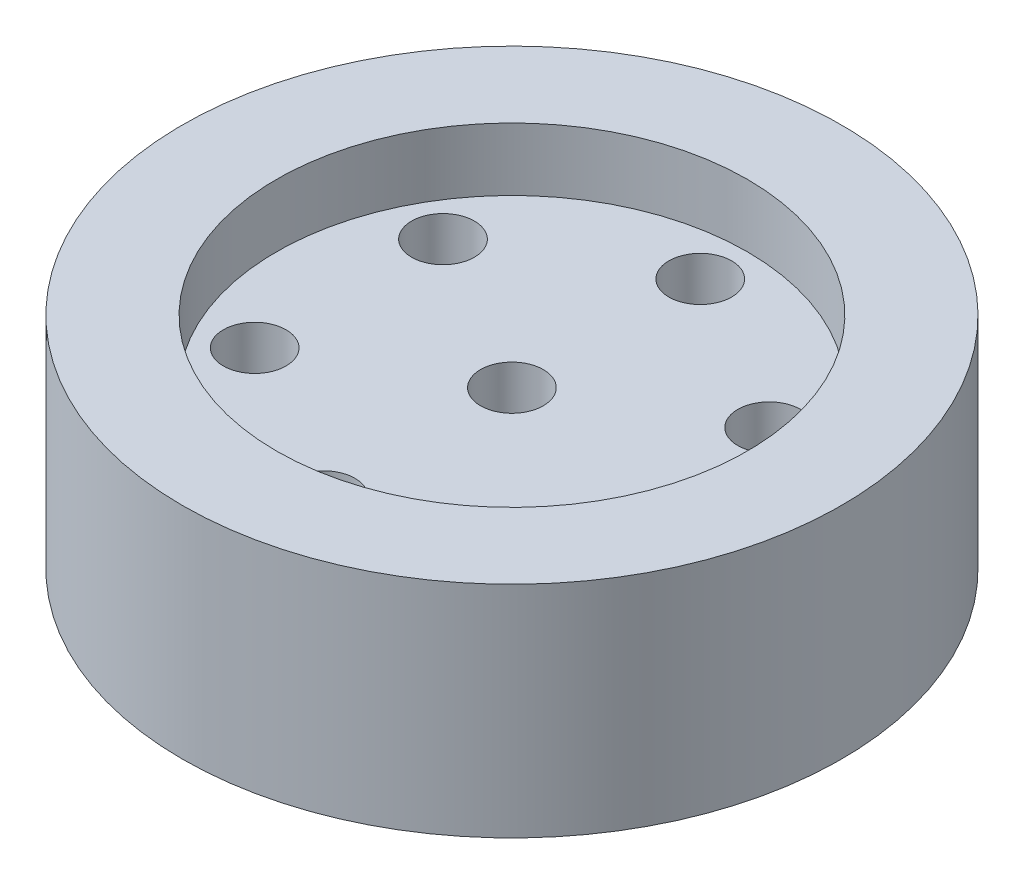
from build123d import *

# Parameters (mm, degrees)
SKETCH1_R           = 21
BOSS_EXTRUDE1_DEPTH = 14
SKETCH2_R           = 15
CUT_EXTRUDE1_DEPTH  = 4
SKETCH3_R           = 19
SKETCH3_R_2         = 5
CUT_EXTRUDE2_DEPTH  = 4
SKETCH4_R           = 2
CUT_EXTRUDE3_DEPTH  = 33.832910319
SKETCH5_R           = 2
CUT_EXTRUDE4_DEPTH  = 32.336879232


with BuildPart() as part:
    # Sketch1 → Boss-Extrude1 (new body)
    with BuildSketch(Plane(origin=(0, 0, 0), x_dir=(1, 0, 0), z_dir=(0, 1, 0))):
        with Locations(Location((0, 0, 0), (0, 0, 270))):
            Circle(SKETCH1_R)
    extrude(amount=BOSS_EXTRUDE1_DEPTH)

    # Sketch2 → Cut-Extrude1 (cut)
    with BuildSketch(Plane(origin=(0, 14, 0), x_dir=(1, 0, 0), z_dir=(0, 1, 0))):
        with Locations(Location((0, 0, 0), (0, 0, 270))):
            Circle(SKETCH2_R)
    extrude(amount=-CUT_EXTRUDE1_DEPTH, mode=Mode.SUBTRACT)

    # Sketch3 → Cut-Extrude2 (cut)
    with BuildSketch(Plane.XZ):
        with Locations(Location((0, 0, 0), (0, 0, 270))):
            Circle(SKETCH3_R)
        with Locations(Location((0, 0, 0), (0, 0, 270))):
            Circle(SKETCH3_R_2, mode=Mode.SUBTRACT)
    extrude(amount=-CUT_EXTRUDE2_DEPTH, mode=Mode.SUBTRACT)

    # Sketch4 → Cut-Extrude3 (cut, through all)
    with BuildSketch(Plane(origin=(0, 0, 0), x_dir=(-1, 0, 0), z_dir=(0, -1, 0))):
        with Locations(Location((0, 0, 0), (0, 0, 90))):
            Circle(SKETCH4_R)
    extrude(amount=-CUT_EXTRUDE3_DEPTH, mode=Mode.SUBTRACT)

    # Sketch5 → Cut-Extrude4 (cut, through all)
    with BuildSketch(Plane(origin=(0, 4, 0), x_dir=(-1, 0, 0), z_dir=(0, -1, 0))):
        with Locations(Location((0, -12, 0), (0, 0, 90))):
            Circle(SKETCH5_R)
        with Locations(Location((-10.392304845, -6, 0), (0, 0, 90))):
            Circle(SKETCH5_R)
        with Locations(Location((-10.392304845, 6, 0), (0, 0, 90))):
            Circle(SKETCH5_R)
        with Locations(Location((0, 12, 0), (0, 0, 90))):
            Circle(SKETCH5_R)
        with Locations(Location((10.392304845, 6, 0), (0, 0, 90))):
            Circle(SKETCH5_R)
        with Locations(Location((10.392304845, -6, 0), (0, 0, 90))):
            Circle(SKETCH5_R)
    extrude(amount=-CUT_EXTRUDE4_DEPTH, mode=Mode.SUBTRACT)


solid = part.part
